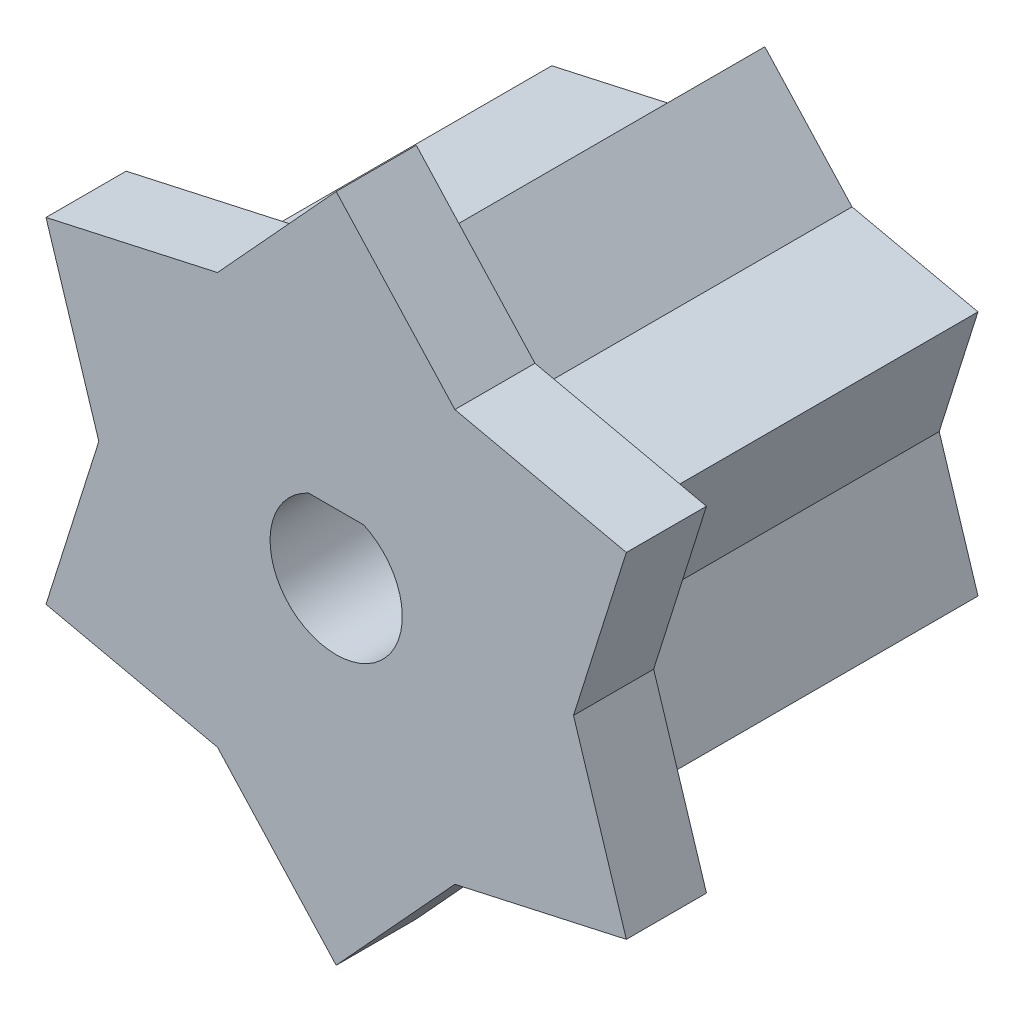
from build123d import *

# Parameters (mm, degrees)
BOSS_EXTRUDE1_DEPTH = 8.7
BOSS_EXTRUDE2_DEPTH = 2
CUT_EXTRUDE2_DEPTH  = 16.391110731
CHAMFER1_SIZE       = 0.4


with BuildPart() as part:
    # Sketch1 → Boss-Extrude1 (new body)
    with BuildSketch(Plane.XY):
        Polygon((2.175697935, 3.768419365), (0, 6.142777017), (-2.175697935, 3.768419365), (-5.319800946, 3.071388508), (-4.351395869, 0), (-5.319800946, -3.071388508), (-2.175697935, -3.768419365), (0, -6.142777017), (2.175697935, -3.768419365), (5.319800946, -3.071388508), (4.351395869, 0), (5.319800946, 3.071388508), align=None)
    extrude(amount=-BOSS_EXTRUDE1_DEPTH)

    # Sketch2 → Boss-Extrude2 (add)
    with BuildSketch(Plane.XY):
        Polygon((7.242620565, 4.181528933), (2.962094779, 5.130498653), (0, 8.363057866), (-2.962094779, 5.130498653), (-7.242620565, 4.181528933), (-5.924189557, 0), (-7.242620565, -4.181528933), (-2.962094779, -5.130498653), (0, -8.363057866), (2.962094779, -5.130498653), (7.242620565, -4.181528933), (5.924189557, 0), align=None)
    extrude(amount=BOSS_EXTRUDE2_DEPTH)

    # Sketch3 → Cut-Extrude2 (cut, through all)
    with BuildSketch(Plane.XY.offset(2)):
        with BuildLine():
            ThreePointArc((1.65, 0), (1.388648171, 0.891154452), (0.687386354, 1.5))
            Line((0.687386354, 1.5), (-0.687386354, 1.5))
            ThreePointArc((-0.687386354, 1.5), (-1.388648171, 0.891154452), (-1.65, 0))
            ThreePointArc((-1.65, 0), (0, -1.65), (1.65, 0))
        make_face()
    extrude(amount=-CUT_EXTRUDE2_DEPTH, mode=Mode.SUBTRACT)

    # Chamfer1
    chamfer1_edges = [part.edges().sort_by_distance(p)[0] for p in [
        (3.74774944, -3.419903937, 0),
        (1.087848967, -4.955598191, 0),
        (-1.087848967, -4.955598191, 0),
        (-3.74774944, -3.419903937, 0),
        (-4.835598408, -1.535694254, 0),
        (-4.835598408, 1.535694254, 0),
        (-3.74774944, 3.419903937, 0),
        (4.835598408, -1.535694254, 0),
        (4.835598408, 1.535694254, 0),
        (3.74774944, 3.419903937, 0),
        (1.087848967, 4.955598191, 0),
        (-1.087848967, 4.955598191, 0),
    ]]
    chamfer(chamfer1_edges, length=CHAMFER1_SIZE)


solid = part.part
